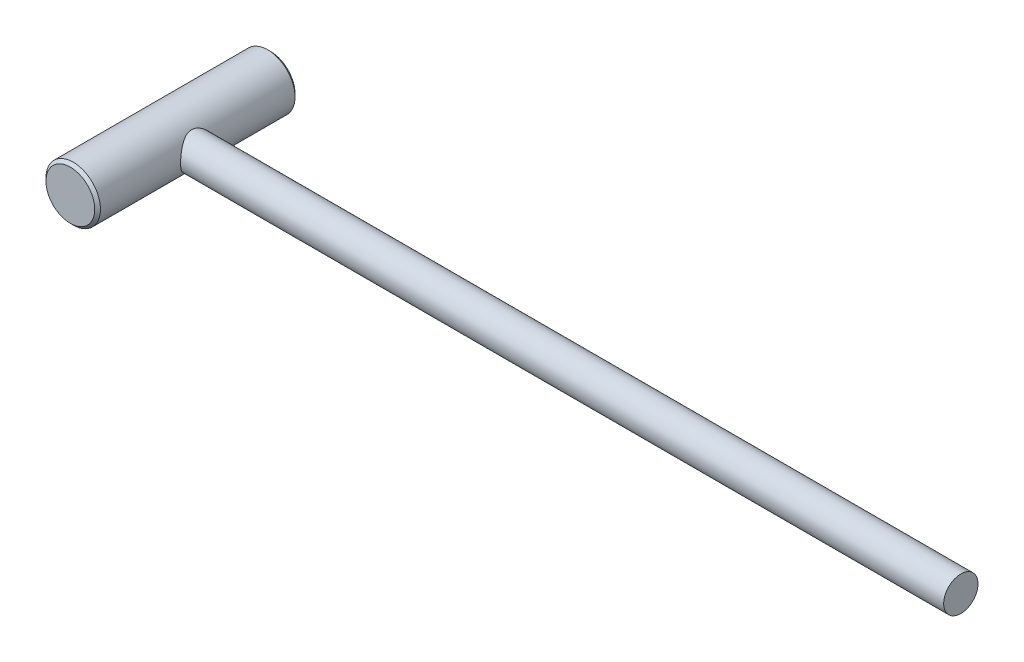
from build123d import *

# Parameters (mm, degrees)
SKETCH1_R                   = 4.7625
BOSS_EXTRUDE1_DEPTH         = 17.5
F_1_4_20_TAPPED_HOLE1_D     = 5.1054
F_1_4_20_TAPPED_HOLE1_DEPTH = 8
F_1_4_20_TAPPED_HOLE1_TIP   = 1.533816902
BOSS_EXTRUDE2_DEPTH         = 133.35
BOSS_EXTRUDE2_DEPTH_BACK    = 7
SKETCH4_R                   = 3
CHAMFER1_SIZE               = 0.5


with BuildPart() as part:
    # Sketch1 → Boss-Extrude1 (new, symmetric)
    with BuildSketch(Plane.XY):
        Circle(SKETCH1_R)
    extrude(amount=BOSS_EXTRUDE1_DEPTH, both=True)

    # 1/4-20 Tapped Hole1
    with Locations(Plane(origin=(4.7625, 0, 0), x_dir=(0, 0, -1), z_dir=(1, 0, 0))):
        with Locations((0, 0)):
            Hole(F_1_4_20_TAPPED_HOLE1_D / 2, depth=F_1_4_20_TAPPED_HOLE1_DEPTH)
            with Locations((0, 0, -(F_1_4_20_TAPPED_HOLE1_DEPTH + F_1_4_20_TAPPED_HOLE1_TIP / 2))):  # 118° drill point
                Cone(0, F_1_4_20_TAPPED_HOLE1_D / 2, F_1_4_20_TAPPED_HOLE1_TIP, mode=Mode.SUBTRACT)

    # Chamfer1
    chamfer1_edges = [part.edges().sort_by_distance(p)[0] for p in [
        (-4.7625, 0, -17.5),
        (-4.7625, 0, 17.5),
    ]]
    chamfer(chamfer1_edges, length=CHAMFER1_SIZE)


with BuildPart() as body_2:
    # Sketch4 → Boss-Extrude2 (new, two sides: drawn at the far end of the back side and taken through both)
    with BuildSketch(Plane(origin=(4.7625, 0, 0), x_dir=(0, 0, -1), z_dir=(1, 0, 0)).offset(-BOSS_EXTRUDE2_DEPTH_BACK)):
        Circle(SKETCH4_R)
    extrude(amount=BOSS_EXTRUDE2_DEPTH + BOSS_EXTRUDE2_DEPTH_BACK)


solid = Compound([part.part, body_2.part])
